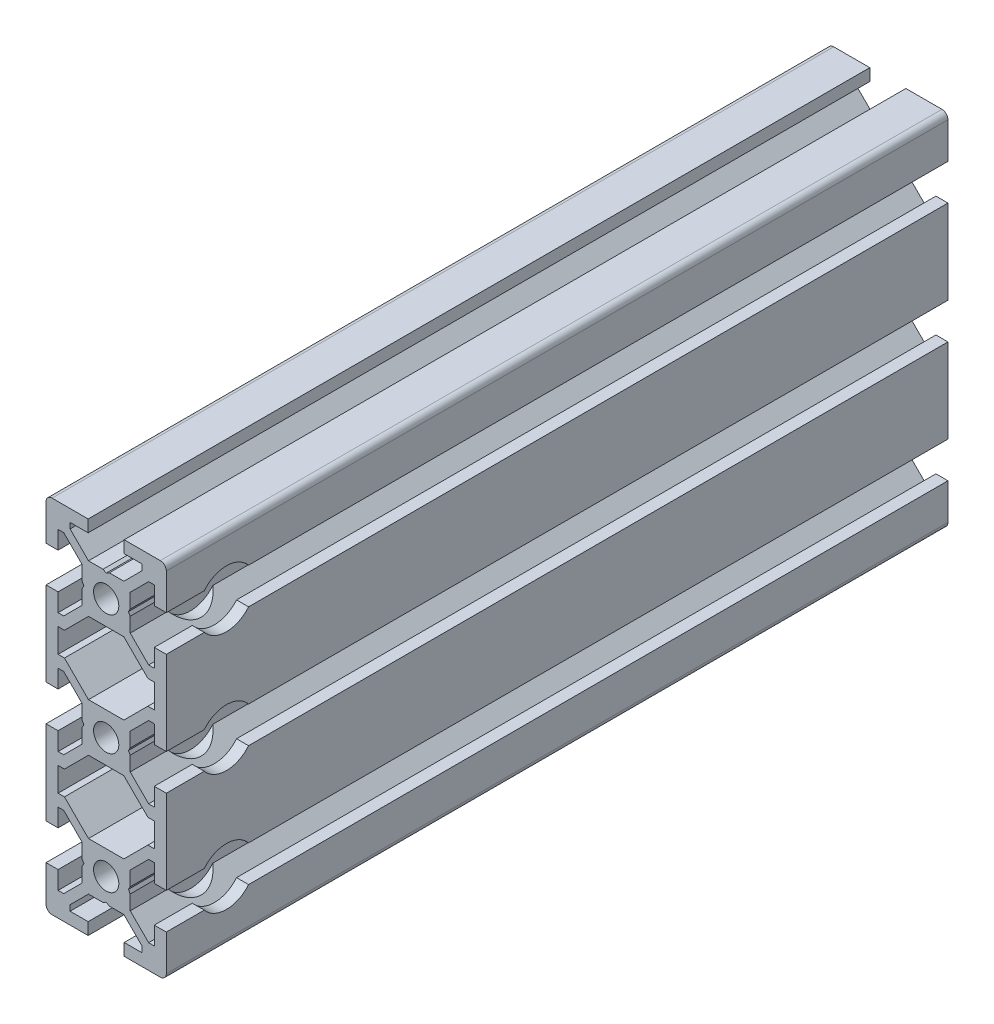
from build123d import *

# Parameters (mm, degrees)
BOSS_EXTRUDE1_DEPTH = 130
SKETCH2_W           = 130
SKETCH2_H           = 2.1
SKETCH3_W           = 130
SKETCH3_H           = 2.1
SKETCH4_W           = 130
SKETCH4_H           = 2.1


with BuildPart() as part:
    # Sketch1 → Boss-Extrude1 (new body)
    with BuildSketch(Plane.XY):
        with BuildLine():
            Line((-10, -17), (-8, -17))
            Line((-8, -17), (-8, -14))
            Line((-8, -14), (-7.060660172, -14))
            Line((-7.060660172, -14), (-4, -17.060660172))
            Line((-4, -17.060660172), (-4, -19.480384758))
            Line((-4, -19.480384758), (-3.7, -20))
            Line((-3.7, -20), (-4, -20.519615242))
            Line((-4, -20.519615242), (-4, -22.939339828))
            Line((-4, -22.939339828), (-7.060660172, -26))
            Line((-7.060660172, -26), (-8, -26))
            Line((-8, -26), (-8, -23))
            Line((-8, -23), (-10, -23))
            Line((-10, -23), (-10, -29))
            ThreePointArc((-10, -29), (-9.707106781, -29.707106781), (-9, -30))
            Line((-9, -30), (-3, -30))
            Line((-3, -30), (-3, -28))
            Line((-3, -28), (-6, -28))
            Line((-6, -28), (-6, -27.060660172))
            Line((-6, -27.060660172), (-2.939339828, -24))
            Line((-2.939339828, -24), (-0.519615242, -24))
            Line((-0.519615242, -24), (0, -23.7))
            Line((0, -23.7), (0.519615242, -24))
            Line((0.519615242, -24), (2.939339828, -24))
            Line((2.939339828, -24), (6, -27.060660172))
            Line((6, -27.060660172), (6, -28))
            Line((6, -28), (3, -28))
            Line((3, -28), (3, -30))
            Line((3, -30), (9, -30))
            ThreePointArc((9, -30), (9.707106781, -29.707106781), (10, -29))
            Line((10, -29), (10, -23))
            Line((10, -23), (8, -23))
            Line((8, -23), (8, -26))
            Line((8, -26), (7.060660172, -26))
            Line((7.060660172, -26), (4, -22.939339828))
            Line((4, -22.939339828), (4, -20.519615242))
            Line((4, -20.519615242), (3.7, -20))
            Line((3.7, -20), (4, -19.480384758))
            Line((4, -19.480384758), (4, -17.060660172))
            Line((4, -17.060660172), (7.060660172, -14))
            Line((7.060660172, -14), (8, -14))
            Line((8, -14), (8, -17))
            Line((8, -17), (10, -17))
            Line((10, -17), (10, -3))
            Line((10, -3), (8, -3))
            Line((8, -3), (8, -6))
            Line((8, -6), (7.060660172, -6))
            Line((7.060660172, -6), (4, -2.939339828))
            Line((4, -2.939339828), (4, -0.519615242))
            Line((4, -0.519615242), (3.7, 0))
            Line((3.7, 0), (4, 0.519615242))
            Line((4, 0.519615242), (4, 2.939339828))
            Line((4, 2.939339828), (7.060660172, 6))
            Line((7.060660172, 6), (8, 6))
            Line((8, 6), (8, 3))
            Line((8, 3), (10, 3))
            Line((10, 3), (10, 17))
            Line((10, 17), (8, 17))
            Line((8, 17), (8, 14))
            Line((8, 14), (7.060660172, 14))
            Line((7.060660172, 14), (4, 17.060660172))
            Line((4, 17.060660172), (4, 19.480384758))
            Line((4, 19.480384758), (3.7, 20))
            Line((3.7, 20), (4, 20.519615242))
            Line((4, 20.519615242), (4, 22.939339828))
            Line((4, 22.939339828), (7.060660172, 26))
            Line((7.060660172, 26), (8, 26))
            Line((8, 26), (8, 23))
            Line((8, 23), (10, 23))
            Line((10, 23), (10, 29))
            ThreePointArc((10, 29), (9.707106781, 29.707106781), (9, 30))
            Line((9, 30), (3, 30))
            Line((3, 30), (3, 28))
            Line((3, 28), (6, 28))
            Line((6, 28), (6, 27.060660172))
            Line((6, 27.060660172), (2.939339828, 24))
            Line((2.939339828, 24), (0.519615242, 24))
            Line((0.519615242, 24), (0, 23.7))
            Line((0, 23.7), (-0.519615242, 24))
            Line((-0.519615242, 24), (-2.939339828, 24))
            Line((-2.939339828, 24), (-6, 27.060660172))
            Line((-6, 27.060660172), (-6, 28))
            Line((-6, 28), (-3, 28))
            Line((-3, 28), (-3, 30))
            Line((-3, 30), (-9, 30))
            ThreePointArc((-9, 30), (-9.707106781, 29.707106781), (-10, 29))
            Line((-10, 29), (-10, 23))
            Line((-10, 23), (-8, 23))
            Line((-8, 23), (-8, 26))
            Line((-8, 26), (-7.060660172, 26))
            Line((-7.060660172, 26), (-4, 22.939339828))
            Line((-4, 22.939339828), (-4, 20.519615242))
            Line((-4, 20.519615242), (-3.7, 20))
            Line((-3.7, 20), (-4, 19.480384758))
            Line((-4, 19.480384758), (-4, 17.060660172))
            Line((-4, 17.060660172), (-7.060660172, 14))
            Line((-7.060660172, 14), (-8, 14))
            Line((-8, 14), (-8, 17))
            Line((-8, 17), (-10, 17))
            Line((-10, 17), (-10, 3))
            Line((-10, 3), (-8, 3))
            Line((-8, 3), (-8, 6))
            Line((-8, 6), (-7.060660172, 6))
            Line((-7.060660172, 6), (-4, 2.939339828))
            Line((-4, 2.939339828), (-4, 0.519615242))
            Line((-4, 0.519615242), (-3.7, 0))
            Line((-3.7, 0), (-4, -0.519615242))
            Line((-4, -0.519615242), (-4, -2.939339828))
            Line((-4, -2.939339828), (-7.060660172, -6))
            Line((-7.060660172, -6), (-8, -6))
            Line((-8, -6), (-8, -3))
            Line((-8, -3), (-10, -3))
            Line((-10, -3), (-10, -17))
        make_face()
        Polygon((-8, 8), (-6.939339828, 8), (-2.939339828, 4), (2.939339828, 4), (6.939339828, 8), (8, 8), (8, 12), (6.939339828, 12), (2.939339828, 16), (-2.939339828, 16), (-6.939339828, 12), (-8, 12), align=None, mode=Mode.SUBTRACT)
        Polygon((-8, -8), (-8, -12), (-6.939339828, -12), (-2.939339828, -16), (2.939339828, -16), (6.939339828, -12), (8, -12), (8, -8), (6.939339828, -8), (2.939339828, -4), (-2.939339828, -4), (-6.939339828, -8), align=None, mode=Mode.SUBTRACT)
    extrude(amount=-BOSS_EXTRUDE1_DEPTH)

    # Sketch2 → Cut-Revolve1 (revolve, cut)
    with BuildSketch(Plane(origin=(0, 0, 0), x_dir=(0, 0, -1), z_dir=(1, 0, 0)), mode=Mode.PRIVATE) as cut_revolve1_sk:
        with Locations((65, 18.95)):
            Rectangle(SKETCH2_W, SKETCH2_H)
    revolve(cut_revolve1_sk.sketch.rotate(Axis((0, 20, 0), (0, 0, -1)), 90), axis=Axis((0, 20, 0), (0, 0, -1)), mode=Mode.SUBTRACT)

    # Sketch3 → Cut-Revolve2 (revolve, cut)
    with BuildSketch(Plane(origin=(0, 0, 0), x_dir=(0, 0, -1), z_dir=(1, 0, 0)), mode=Mode.PRIVATE) as cut_revolve2_sk:
        with Locations((65, -1.05)):
            Rectangle(SKETCH3_W, SKETCH3_H)
    revolve(cut_revolve2_sk.sketch.rotate(Axis((0, 0, 0), (0, 0, -1)), 90), axis=Axis((0, 0, 0), (0, 0, -1)), mode=Mode.SUBTRACT)

    # Sketch4 → Cut-Revolve3 (revolve, cut)
    with BuildSketch(Plane(origin=(0, 0, 0), x_dir=(0, 0, -1), z_dir=(1, 0, 0)), mode=Mode.PRIVATE) as cut_revolve3_sk:
        with Locations((65, -21.05)):
            Rectangle(SKETCH4_W, SKETCH4_H)
    revolve(cut_revolve3_sk.sketch.rotate(Axis((0, -20, 0), (0, 0, -1)), 90), axis=Axis((0, -20, 0), (0, 0, -1)), mode=Mode.SUBTRACT)

    # Sketch5 → Cut-Revolve4 (revolve, cut)
    with BuildSketch(Plane(origin=(0, 20, 0), x_dir=(1, 0, 0), z_dir=(0, 1, 0)), mode=Mode.PRIVATE) as cut_revolve4_sk:
        Polygon((-10, 10), (-10, 12.75), (4, 12.75), (4, 14.75), (10, 14.75), (10, 10), align=None)
    revolve(cut_revolve4_sk.sketch.rotate(Axis((10, 20, -10), (-1, 0, 0)), 180), axis=Axis((10, 20, -10), (-1, 0, 0)), mode=Mode.SUBTRACT)

    # Sketch6 → Cut-Revolve5 (revolve, cut)
    with BuildSketch(Plane(origin=(0, 0, 0), x_dir=(1, 0, 0), z_dir=(0, 1, 0)), mode=Mode.PRIVATE) as cut_revolve5_sk:
        Polygon((-10, 10), (-10, 12.75), (4, 12.75), (4, 14.75), (10, 14.75), (10, 10), align=None)
    revolve(cut_revolve5_sk.sketch.rotate(Axis((10, 0, -10), (-1, 0, 0)), 180), axis=Axis((10, 0, -10), (-1, 0, 0)), mode=Mode.SUBTRACT)

    # Sketch7 → Cut-Revolve6 (revolve, cut)
    with BuildSketch(Plane(origin=(0, -20, 0), x_dir=(1, 0, 0), z_dir=(0, 1, 0)), mode=Mode.PRIVATE) as cut_revolve6_sk:
        Polygon((-10, 10), (-10, 12.75), (4, 12.75), (4, 14.75), (10, 14.75), (10, 10), align=None)
    revolve(cut_revolve6_sk.sketch.rotate(Axis((10, -20, -10), (-1, 0, 0)), 180), axis=Axis((10, -20, -10), (-1, 0, 0)), mode=Mode.SUBTRACT)


solid = part.part
